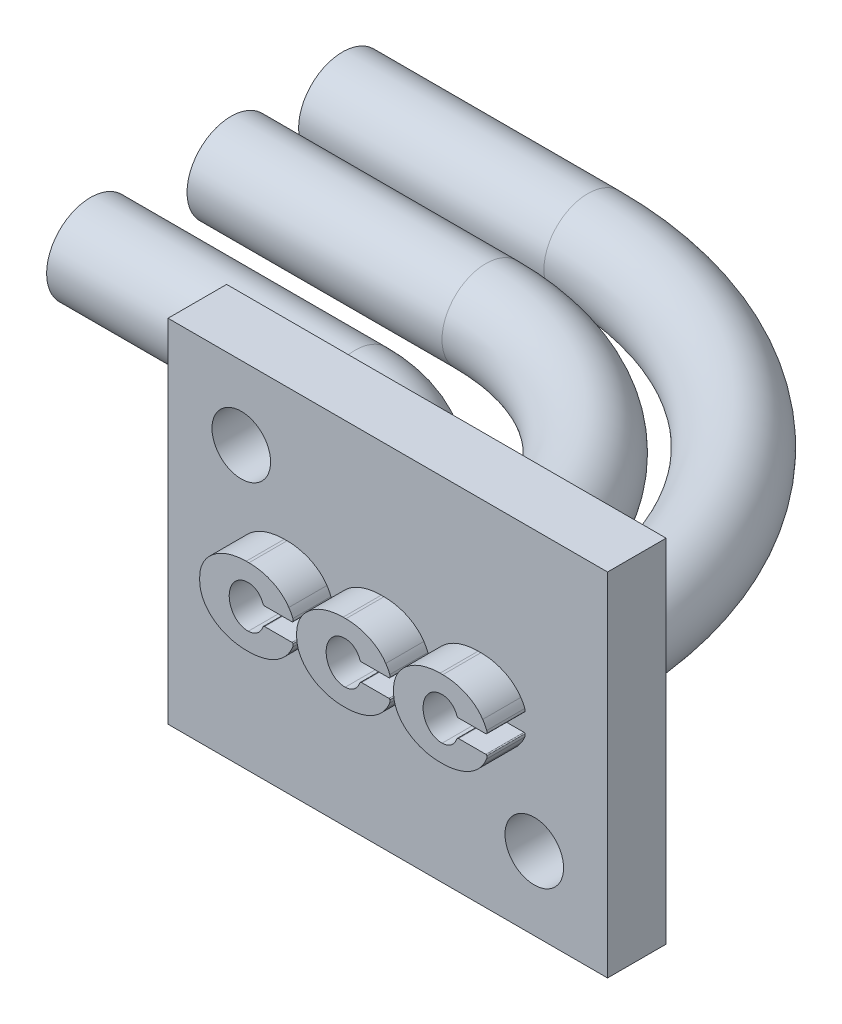
from build123d import *

# Parameters (mm, degrees)
SKETCH1_W           = 15
SKETCH1_H           = 12
BOSS_EXTRUDE1_DEPTH = 2
BOSS_EXTRUDE2_DEPTH = 2
SKETCH3_W           = 1.5
SKETCH3_H           = 4
BOSS_EXTRUDE3_DEPTH = 2
SKETCH12_W          = 14.1
SKETCH12_H          = 8
CUT_EXTRUDE1_DEPTH  = 22.443180832
SKETCH8_R           = 1.5
SKETCH7_R           = 1.5
SKETCH6_R           = 1.5
SKETCH13_R          = 1
CUT_EXTRUDE2_DEPTH  = 24.279403135
CUT_EXTRUDE3_START  = -0.7
CUT_EXTRUDE3_DEPTH  = 0.7


with BuildPart() as part:
    # Sketch1 → Boss-Extrude1 (new body)
    with BuildSketch(Plane.XY):
        Rectangle(SKETCH1_W, SKETCH1_H)
    extrude(amount=BOSS_EXTRUDE1_DEPTH)

    # Sketch2 → Boss-Extrude2 (add)
    with BuildSketch(Plane.XY.offset(2)):
        with BuildLine():
            Line((0.407238435, 0.442322853), (1.343073358, 0.442322853))
            ThreePointArc((1.343073358, 0.442322853), (1.361383578, 0.450410651), (1.372317406, 0.467177524))
            ThreePointArc((1.372317406, 0.467177524), (1.375503859, 0.511169305), (1.368128847, 0.554655388))
            ThreePointArc((1.368128847, 0.554655388), (1.307680997, 0.687640629), (1.230966735, 0.811954502))
            add(Edge.make_bspline(
                [(1.230966735, 0.811954502), (0.812669173, 1.453088874), (-0.130132299, 1.453088874)],
                knots=[0.342748392, 0.342748392, 0.342748392, 1.381331695, 1.381331695, 1.381331695], degree=2, weights=[1, 0.868170926, 1]))
            Line((-0.130132299, 1.453088874), (-0.223753352, 1.45308889))
            add(Edge.make_bspline(
                [(-0.223753352, 1.45308889), (-1.809410214, 1.45308889), (-1.809410214, 0.201933814)],
                knots=[4.81203319, 4.81203319, 4.81203319, 6.344970327, 6.344970327, 6.344970327], degree=2, weights=[1, 0.720364542, 1]))
            Line((-1.809410214, 0.201933814), (-1.809410207, 0.071803559))
            add(Edge.make_bspline(
                [(-1.809410207, 0.071803559), (-1.809410207, -1.179351517), (-0.223753345, -1.179351517)],
                knots=[3.079807634, 3.079807634, 3.079807634, 4.612744771, 4.612744771, 4.612744771], degree=2, weights=[1, 0.720364542, 1]))
            Line((-0.223753345, -1.179351517), (-0.130132292, -1.179351553))
            add(Edge.make_bspline(
                [(-0.130132292, -1.179351553), (0.81266918, -1.179351553), (1.230966742, -0.53821718)],
                knots=[1.760260959, 1.760260959, 1.760260959, 2.798844261, 2.798844261, 2.798844261], degree=2, weights=[1, 0.868170926, 1]))
            ThreePointArc((1.230966742, -0.53821718), (1.304716836, -0.419114346), (1.363380807, -0.291901532))
            ThreePointArc((1.363380807, -0.291901532), (1.374973795, -0.243578219), (1.373211686, -0.193915004))
            ThreePointArc((1.373211686, -0.193915004), (1.361207126, -0.172992015), (1.338547111, -0.164721302))
            Line((1.338547111, -0.164721302), (0.407238389, -0.164721302))
            ThreePointArc((0.407238389, -0.164721302), (0.369470559, -0.176722101), (0.34555702, -0.208322271))
            add(Edge.make_bspline(
                [(-0.150934559, -0.579205825), (0.214173352, -0.579565029), (0.34555702, -0.208322271)],
                knots=[5.955155363, 5.955155363, 5.955155363, 7.020735545, 7.020735545, 7.020735545], degree=2, weights=[1, 0.86139323, 1]))
            add(Edge.make_bspline(
                [(-0.210727715, 0.853430346), (-0.832817449, 0.821972711), (-0.802831579, 0.103515223), (-0.77284571, -0.614942265), (-0.150934559, -0.579205825)],
                knots=[3.181025595, 3.181025595, 3.181025595, 4.754799698, 4.754799698, 6.328573801, 6.328573801, 6.328573801], degree=2, weights=[1, 0.706053195, 1, 0.706053195, 1]))
            add(Edge.make_bspline(
                [(0.345557015, 0.485923858), (0.199318189, 0.899141892), (-0.210727715, 0.853430346)],
                knots=[5.545635094, 5.545635094, 5.545635094, 6.707278348, 6.707278348, 6.707278348], degree=2, weights=[1, 0.836012096, 1]))
            ThreePointArc((0.345557015, 0.485923858), (0.369470574, 0.454323662), (0.407238435, 0.442322853))
        make_face()
        with BuildLine():
            Line((-2.901066111, 0.442322853), (-1.965231187, 0.442322853))
            ThreePointArc((-1.965231187, 0.442322853), (-1.946920937, 0.450410638), (-1.935987089, 0.467177524))
            ThreePointArc((-1.935987089, 0.467177524), (-1.932800635, 0.511169305), (-1.940175648, 0.554655388))
            ThreePointArc((-1.940175648, 0.554655388), (-2.000623497, 0.687640629), (-2.077337759, 0.811954502))
            add(Edge.make_bspline(
                [(-2.077337759, 0.811954502), (-2.495635321, 1.453088874), (-3.438436793, 1.453088874)],
                knots=[0.342748392, 0.342748392, 0.342748392, 1.381331695, 1.381331695, 1.381331695], degree=2, weights=[1, 0.868170926, 1]))
            Line((-3.438436793, 1.453088874), (-3.532057847, 1.45308889))
            add(Edge.make_bspline(
                [(-3.532057847, 1.45308889), (-5.117714708, 1.45308889), (-5.117714708, 0.201933814)],
                knots=[4.81203319, 4.81203319, 4.81203319, 6.344970327, 6.344970327, 6.344970327], degree=2, weights=[1, 0.720364542, 1]))
            Line((-5.117714708, 0.201933814), (-5.117714753, 0.071803559))
            add(Edge.make_bspline(
                [(-5.117714753, 0.071803559), (-5.117714753, -1.179351517), (-3.532057891, -1.179351517)],
                knots=[3.079807634, 3.079807634, 3.079807634, 4.612744771, 4.612744771, 4.612744771], degree=2, weights=[1, 0.720364542, 1]))
            Line((-3.532057891, -1.179351517), (-3.438436838, -1.179351553))
            add(Edge.make_bspline(
                [(-3.438436838, -1.179351553), (-2.495635366, -1.179351553), (-2.077337803, -0.53821718)],
                knots=[4.901853612, 4.901853612, 4.901853612, 5.940436915, 5.940436915, 5.940436915], degree=2, weights=[1, 0.868170926, 1]))
            ThreePointArc((-2.077337803, -0.53821718), (-2.003587709, -0.419114346), (-1.944923738, -0.291901532))
            ThreePointArc((-1.944923738, -0.291901532), (-1.933330751, -0.243578219), (-1.935092859, -0.193915004))
            ThreePointArc((-1.935092859, -0.193915004), (-1.94709742, -0.172992015), (-1.969757434, -0.164721302))
            Line((-1.969757434, -0.164721302), (-2.901066156, -0.164721302))
            ThreePointArc((-2.901066156, -0.164721302), (-2.938833986, -0.176722101), (-2.962747525, -0.208322271))
            add(Edge.make_bspline(
                [(-3.459239104, -0.579205825), (-3.094131193, -0.579565029), (-2.962747525, -0.208322271)],
                knots=[2.81356271, 2.81356271, 2.81356271, 3.879142891, 3.879142891, 3.879142891], degree=2, weights=[1, 0.86139323, 1]))
            add(Edge.make_bspline(
                [(-3.51903226, 0.853430346), (-4.141121994, 0.821972711), (-4.111136125, 0.103515223), (-4.081150255, -0.614942265), (-3.459239104, -0.579205825)],
                knots=[0.039432941, 0.039432941, 0.039432941, 1.613207044, 1.613207044, 3.186981147, 3.186981147, 3.186981147], degree=2, weights=[1, 0.706053195, 1, 0.706053195, 1]))
            add(Edge.make_bspline(
                [(-2.962747531, 0.485923858), (-3.108986357, 0.899141892), (-3.51903226, 0.853430346)],
                knots=[5.545635094, 5.545635094, 5.545635094, 6.707278348, 6.707278348, 6.707278348], degree=2, weights=[1, 0.836012096, 1]))
            ThreePointArc((-2.962747531, 0.485923858), (-2.938833971, 0.454323662), (-2.901066111, 0.442322853))
        make_face()
        with BuildLine():
            Line((3.715542981, 0.442322853), (4.651377904, 0.442322853))
            ThreePointArc((4.651377904, 0.442322853), (4.669688124, 0.450410651), (4.680621952, 0.467177524))
            ThreePointArc((4.680621952, 0.467177524), (4.683808405, 0.511169305), (4.676433393, 0.554655388))
            ThreePointArc((4.676433393, 0.554655388), (4.615985543, 0.687640629), (4.539271281, 0.811954502))
            add(Edge.make_bspline(
                [(4.539271281, 0.811954502), (4.120973719, 1.453088874), (3.178172247, 1.453088874)],
                knots=[0.342748392, 0.342748392, 0.342748392, 1.381331695, 1.381331695, 1.381331695], degree=2, weights=[1, 0.868170926, 1]))
            Line((3.178172247, 1.453088874), (3.084551194, 1.45308889))
            add(Edge.make_bspline(
                [(3.084551194, 1.45308889), (1.498894332, 1.45308889), (1.498894332, 0.201933814)],
                knots=[4.81203319, 4.81203319, 4.81203319, 6.344970327, 6.344970327, 6.344970327], degree=2, weights=[1, 0.720364542, 1]))
            Line((1.498894332, 0.201933814), (1.498894339, 0.071803559))
            add(Edge.make_bspline(
                [(1.498894339, 0.071803559), (1.498894339, -1.179351517), (3.084551201, -1.179351517)],
                knots=[3.079807634, 3.079807634, 3.079807634, 4.612744771, 4.612744771, 4.612744771], degree=2, weights=[1, 0.720364542, 1]))
            Line((3.084551201, -1.179351517), (3.178172254, -1.179351553))
            add(Edge.make_bspline(
                [(3.178172254, -1.179351553), (4.120973726, -1.179351553), (4.539271288, -0.53821718)],
                knots=[1.760260959, 1.760260959, 1.760260959, 2.798844261, 2.798844261, 2.798844261], degree=2, weights=[1, 0.868170926, 1]))
            ThreePointArc((4.539271288, -0.53821718), (4.613021382, -0.419114346), (4.671685353, -0.291901532))
            ThreePointArc((4.671685353, -0.291901532), (4.683278341, -0.243578219), (4.681516232, -0.193915004))
            ThreePointArc((4.681516232, -0.193915004), (4.669511672, -0.172992015), (4.646851657, -0.164721302))
            Line((4.646851657, -0.164721302), (3.715542935, -0.164721302))
            ThreePointArc((3.715542935, -0.164721302), (3.677775105, -0.176722101), (3.653861566, -0.208322271))
            add(Edge.make_bspline(
                [(3.157369987, -0.579205825), (3.522477898, -0.579565029), (3.653861566, -0.208322271)],
                knots=[5.955155363, 5.955155363, 5.955155363, 7.020735545, 7.020735545, 7.020735545], degree=2, weights=[1, 0.86139323, 1]))
            add(Edge.make_bspline(
                [(3.097576831, 0.853430346), (2.475487097, 0.821972711), (2.505472967, 0.103515223), (2.535458836, -0.614942265), (3.157369987, -0.579205825)],
                knots=[3.181025595, 3.181025595, 3.181025595, 4.754799698, 4.754799698, 6.328573801, 6.328573801, 6.328573801], degree=2, weights=[1, 0.706053195, 1, 0.706053195, 1]))
            add(Edge.make_bspline(
                [(3.653861561, 0.485923858), (3.507622735, 0.899141892), (3.097576831, 0.853430346)],
                knots=[5.545635094, 5.545635094, 5.545635094, 6.707278348, 6.707278348, 6.707278348], degree=2, weights=[1, 0.836012096, 1]))
            ThreePointArc((3.653861561, 0.485923858), (3.67777512, 0.454323662), (3.715542981, 0.442322853))
        make_face()
    extrude(amount=BOSS_EXTRUDE2_DEPTH)

    # Sketch3 → Boss-Extrude3 (add, symmetric)
    with BuildSketch(Plane(origin=(0, 0, 0), x_dir=(1, 0, 0), z_dir=(0, 1, 0))):
        Polygon((2.72873188, 0), (4.22873188, 0), (4.22873188, 14.1), (-2.422646748, 14.1), (-2.422646748, 12.6), (2.72873188, 12.6), align=None)
        with Locations((-3.864025386, 2)):
            Rectangle(SKETCH3_W, SKETCH3_H)
        Polygon((-0.942646753, 0), (0.557353247, 0), (0.557353247, 10.1), (-2.642646753, 10.1), (-2.642646753, 8.6), (-0.942646753, 8.6), align=None)
    extrude(amount=BOSS_EXTRUDE3_DEPTH, both=True)

    # Sketch12 → Cut-Extrude1 (cut, through all)
    with BuildSketch(Plane(origin=(7.5, 0, 0), x_dir=(0, 0, -1), z_dir=(1, 0, 0))):
        with Locations((7.05, -2)):
            Rectangle(SKETCH12_W, SKETCH12_H)
    extrude(amount=-CUT_EXTRUDE1_DEPTH, mode=Mode.SUBTRACT)

    # Sweep1: sweep along a path in Sketch9
    with BuildLine(Plane(origin=(0, 0, 0), x_dir=(1, 0, 0), z_dir=(0, 1, 0))) as sweep1_path:
        Line((-3.864025386, 0), (-3.864025386, 0.75))
        ThreePointArc((-3.864025386, 0.75), (-5.035598261, 3.578427125), (-7.864025386, 4.75))
        Line((-7.864025386, 4.75), (-16.894025386, 4.75))
    # Sketch8 → Sweep1 (sweep)
    with BuildSketch(Plane(origin=(0, 0, 0), x_dir=(-1, 0, 0), z_dir=(0, 0, -1))):
        with Locations((3.864025386, 0)):
            Circle(SKETCH8_R)
    sweep(path=sweep1_path.line)

    # Sweep2: sweep along a path in Sketch10
    with BuildLine(Plane(origin=(0, 0, 0), x_dir=(1, 0, 0), z_dir=(0, 1, 0))) as sweep2_path:
        Line((-0.192646753, 0), (-0.192646753, 1.35))
        ThreePointArc((-0.192646753, 1.35), (-2.535792503, 7.006854249), (-8.192646753, 9.35))
        Line((-8.192646753, 9.35), (-16.894025753, 9.35))
    # Sketch7 → Sweep2 (sweep)
    with BuildSketch(Plane(origin=(0, 0, 0), x_dir=(-1, 0, 0), z_dir=(0, 0, -1))):
        Circle(SKETCH7_R)
    sweep(path=sweep2_path.line)

    # Sweep3: sweep along a path in Sketch11
    with BuildLine(Plane(origin=(0, 0, 0), x_dir=(1, 0, 0), z_dir=(0, 1, 0))) as sweep3_path:
        Line((3.47873188, 0), (3.47873188, 1.35))
        ThreePointArc((3.47873188, 1.35), (-0.035986746, 9.835281374), (-8.52126812, 13.35))
        Line((-8.52126812, 13.35), (-16.89402512, 13.35))
    # Sketch6 → Sweep3 (sweep)
    with BuildSketch(Plane(origin=(0, 0, 0), x_dir=(-1, 0, 0), z_dir=(0, 0, -1))):
        with Locations((-3.47873188, 0)):
            Circle(SKETCH6_R)
    sweep(path=sweep3_path.line)

    # Sketch13 → Cut-Extrude2 (cut, through all)
    with BuildSketch(Plane(origin=(0, 0, 0), x_dir=(-1, 0, 0), z_dir=(0, 0, -1))):
        with Locations((-5, -3.5)):
            Circle(SKETCH13_R)
        with Locations((5, 3.5)):
            Circle(SKETCH13_R)
    extrude(amount=-CUT_EXTRUDE2_DEPTH, mode=Mode.SUBTRACT)

    # Sketch15 → Cut-Extrude3 (cut)
    with BuildSketch(Plane.XY.offset(4).offset(CUT_EXTRUDE3_START)):
        with BuildLine():
            Line((-2.901066111, 0.442322853), (-1.965231187, 0.442322853))
            ThreePointArc((-1.965231187, 0.442322853), (-1.946920937, 0.450410638), (-1.935987089, 0.467177524))
            ThreePointArc((-1.935987089, 0.467177524), (-1.932800635, 0.511169305), (-1.940175648, 0.554655388))
            ThreePointArc((-1.940175648, 0.554655388), (-2.000623497, 0.687640629), (-2.077337759, 0.811954502))
            add(Edge.make_bspline(
                [(-2.077337759, 0.811954502), (-2.495635321, 1.453088874), (-3.438436793, 1.453088874)],
                knots=[3.484341046, 3.484341046, 3.484341046, 4.522924348, 4.522924348, 4.522924348], degree=2, weights=[1, 0.868170926, 1]))
            Line((-3.438436793, 1.453088874), (-3.532057847, 1.45308889))
            add(Edge.make_bspline(
                [(-3.532057847, 1.45308889), (-5.117714708, 1.45308889), (-5.117714708, 0.201933814)],
                knots=[4.81203319, 4.81203319, 4.81203319, 6.344970327, 6.344970327, 6.344970327], degree=2, weights=[1, 0.720364542, 1]))
            Line((-5.117714708, 0.201933814), (-5.117714753, 0.071803559))
            add(Edge.make_bspline(
                [(-5.117714753, 0.071803559), (-5.117714753, -1.179351517), (-3.532057891, -1.179351517)],
                knots=[3.079807634, 3.079807634, 3.079807634, 4.612744771, 4.612744771, 4.612744771], degree=2, weights=[1, 0.720364542, 1]))
            Line((-3.532057891, -1.179351517), (-3.438436838, -1.179351553))
            add(Edge.make_bspline(
                [(-3.438436838, -1.179351553), (-2.495635366, -1.179351553), (-2.077337803, -0.53821718)],
                knots=[1.760260959, 1.760260959, 1.760260959, 2.798844261, 2.798844261, 2.798844261], degree=2, weights=[1, 0.868170926, 1]))
            ThreePointArc((-2.077337803, -0.53821718), (-2.003587709, -0.419114346), (-1.944923738, -0.291901532))
            ThreePointArc((-1.944923738, -0.291901532), (-1.933330751, -0.243578219), (-1.935092859, -0.193915004))
            ThreePointArc((-1.935092859, -0.193915004), (-1.94709742, -0.172992015), (-1.969757434, -0.164721302))
            Line((-1.969757434, -0.164721302), (-2.901066156, -0.164721302))
            ThreePointArc((-2.901066156, -0.164721302), (-2.938833986, -0.176722101), (-2.962747525, -0.208322271))
            add(Edge.make_bspline(
                [(-3.459239104, -0.579205825), (-3.094131193, -0.579565029), (-2.962747525, -0.208322271)],
                knots=[5.955155363, 5.955155363, 5.955155363, 7.020735545, 7.020735545, 7.020735545], degree=2, weights=[1, 0.86139323, 1]))
            add(Edge.make_bspline(
                [(-3.51903226, 0.853430346), (-4.141121994, 0.821972711), (-4.111136125, 0.103515223), (-4.081150255, -0.614942265), (-3.459239104, -0.579205825)],
                knots=[3.181025595, 3.181025595, 3.181025595, 4.754799698, 4.754799698, 6.328573801, 6.328573801, 6.328573801], degree=2, weights=[1, 0.706053195, 1, 0.706053195, 1]))
            add(Edge.make_bspline(
                [(-2.962747531, 0.485923858), (-3.108986357, 0.899141892), (-3.51903226, 0.853430346)],
                knots=[2.40404244, 2.40404244, 2.40404244, 3.565685694, 3.565685694, 3.565685694], degree=2, weights=[1, 0.836012096, 1]))
            ThreePointArc((-2.962747531, 0.485923858), (-2.938833971, 0.454323662), (-2.901066111, 0.442322853))
        make_face()
        with BuildLine():
            Line((0.407238435, 0.442322853), (1.343073358, 0.442322853))
            ThreePointArc((1.343073358, 0.442322853), (1.361383578, 0.450410651), (1.372317406, 0.467177524))
            ThreePointArc((1.372317406, 0.467177524), (1.375503859, 0.511169305), (1.368128847, 0.554655388))
            ThreePointArc((1.368128847, 0.554655388), (1.307680997, 0.687640629), (1.230966735, 0.811954502))
            add(Edge.make_bspline(
                [(1.230966735, 0.811954502), (0.812669173, 1.453088874), (-0.130132299, 1.453088874)],
                knots=[0.342748392, 0.342748392, 0.342748392, 1.381331695, 1.381331695, 1.381331695], degree=2, weights=[1, 0.868170926, 1]))
            Line((-0.130132299, 1.453088874), (-0.223753352, 1.45308889))
            add(Edge.make_bspline(
                [(-0.223753352, 1.45308889), (-1.809410214, 1.45308889), (-1.809410214, 0.201933814)],
                knots=[4.81203319, 4.81203319, 4.81203319, 6.344970327, 6.344970327, 6.344970327], degree=2, weights=[1, 0.720364542, 1]))
            Line((-1.809410214, 0.201933814), (-1.809410207, 0.071803559))
            add(Edge.make_bspline(
                [(-1.809410207, 0.071803559), (-1.809410207, -1.179351517), (-0.223753345, -1.179351517)],
                knots=[3.079807634, 3.079807634, 3.079807634, 4.612744771, 4.612744771, 4.612744771], degree=2, weights=[1, 0.720364542, 1]))
            Line((-0.223753345, -1.179351517), (-0.130132292, -1.179351553))
            add(Edge.make_bspline(
                [(-0.130132292, -1.179351553), (0.81266918, -1.179351553), (1.230966742, -0.53821718)],
                knots=[1.760260959, 1.760260959, 1.760260959, 2.798844261, 2.798844261, 2.798844261], degree=2, weights=[1, 0.868170926, 1]))
            ThreePointArc((1.230966742, -0.53821718), (1.304716836, -0.419114346), (1.363380807, -0.291901532))
            ThreePointArc((1.363380807, -0.291901532), (1.374973795, -0.243578219), (1.373211686, -0.193915004))
            ThreePointArc((1.373211686, -0.193915004), (1.361207126, -0.172992015), (1.338547111, -0.164721302))
            Line((1.338547111, -0.164721302), (0.407238389, -0.164721302))
            ThreePointArc((0.407238389, -0.164721302), (0.369470559, -0.176722101), (0.34555702, -0.208322271))
            add(Edge.make_bspline(
                [(-0.150934559, -0.579205825), (0.214173352, -0.579565029), (0.34555702, -0.208322271)],
                knots=[5.955155363, 5.955155363, 5.955155363, 7.020735545, 7.020735545, 7.020735545], degree=2, weights=[1, 0.86139323, 1]))
            add(Edge.make_bspline(
                [(-0.210727715, 0.853430346), (-0.832817449, 0.821972711), (-0.802831579, 0.103515223), (-0.77284571, -0.614942265), (-0.150934559, -0.579205825)],
                knots=[3.181025595, 3.181025595, 3.181025595, 4.754799698, 4.754799698, 6.328573801, 6.328573801, 6.328573801], degree=2, weights=[1, 0.706053195, 1, 0.706053195, 1]))
            add(Edge.make_bspline(
                [(0.345557015, 0.485923858), (0.199318189, 0.899141892), (-0.210727715, 0.853430346)],
                knots=[2.404042441, 2.404042441, 2.404042441, 3.565685694, 3.565685694, 3.565685694], degree=2, weights=[1, 0.836012096, 1]))
            ThreePointArc((0.345557015, 0.485923858), (0.369470574, 0.454323662), (0.407238435, 0.442322853))
        make_face()
        with BuildLine():
            Line((3.715542981, 0.442322853), (4.651377904, 0.442322853))
            ThreePointArc((4.651377904, 0.442322853), (4.669688124, 0.450410651), (4.680621952, 0.467177524))
            ThreePointArc((4.680621952, 0.467177524), (4.683808405, 0.511169305), (4.676433393, 0.554655388))
            ThreePointArc((4.676433393, 0.554655388), (4.615985543, 0.687640629), (4.539271281, 0.811954502))
            add(Edge.make_bspline(
                [(4.539271281, 0.811954502), (4.120973719, 1.453088874), (3.178172247, 1.453088874)],
                knots=[0.342748392, 0.342748392, 0.342748392, 1.381331695, 1.381331695, 1.381331695], degree=2, weights=[1, 0.868170926, 1]))
            Line((3.178172247, 1.453088874), (3.084551194, 1.45308889))
            add(Edge.make_bspline(
                [(3.084551194, 1.45308889), (1.498894332, 1.45308889), (1.498894332, 0.201933814)],
                knots=[1.670440536, 1.670440536, 1.670440536, 3.203377674, 3.203377674, 3.203377674], degree=2, weights=[1, 0.720364542, 1]))
            Line((1.498894332, 0.201933814), (1.498894339, 0.071803559))
            add(Edge.make_bspline(
                [(1.498894339, 0.071803559), (1.498894339, -1.179351517), (3.084551201, -1.179351517)],
                knots=[3.079807634, 3.079807634, 3.079807634, 4.612744771, 4.612744771, 4.612744771], degree=2, weights=[1, 0.720364542, 1]))
            Line((3.084551201, -1.179351517), (3.178172254, -1.179351553))
            add(Edge.make_bspline(
                [(3.178172254, -1.179351553), (4.120973726, -1.179351553), (4.539271288, -0.53821718)],
                knots=[1.760260959, 1.760260959, 1.760260959, 2.798844261, 2.798844261, 2.798844261], degree=2, weights=[1, 0.868170926, 1]))
            ThreePointArc((4.539271288, -0.53821718), (4.613021382, -0.419114346), (4.671685353, -0.291901532))
            ThreePointArc((4.671685353, -0.291901532), (4.683278341, -0.243578219), (4.681516232, -0.193915004))
            ThreePointArc((4.681516232, -0.193915004), (4.669511672, -0.172992015), (4.646851657, -0.164721302))
            Line((4.646851657, -0.164721302), (3.715542935, -0.164721302))
            ThreePointArc((3.715542935, -0.164721302), (3.677775105, -0.176722101), (3.653861566, -0.208322271))
            add(Edge.make_bspline(
                [(3.157369987, -0.579205825), (3.522477898, -0.579565029), (3.653861566, -0.208322271)],
                knots=[5.955155363, 5.955155363, 5.955155363, 7.020735545, 7.020735545, 7.020735545], degree=2, weights=[1, 0.86139323, 1]))
            add(Edge.make_bspline(
                [(3.097576831, 0.853430346), (2.475487097, 0.821972711), (2.505472967, 0.103515223), (2.535458836, -0.614942265), (3.157369987, -0.579205825)],
                knots=[3.181025595, 3.181025595, 3.181025595, 4.754799698, 4.754799698, 6.328573801, 6.328573801, 6.328573801], degree=2, weights=[1, 0.706053195, 1, 0.706053195, 1]))
            add(Edge.make_bspline(
                [(3.653861561, 0.485923858), (3.507622735, 0.899141892), (3.097576831, 0.853430346)],
                knots=[2.404042441, 2.404042441, 2.404042441, 3.565685694, 3.565685694, 3.565685694], degree=2, weights=[1, 0.836012096, 1]))
            ThreePointArc((3.653861561, 0.485923858), (3.67777512, 0.454323662), (3.715542981, 0.442322853))
        make_face()
    extrude(amount=CUT_EXTRUDE3_DEPTH, mode=Mode.SUBTRACT)


solid = part.part
